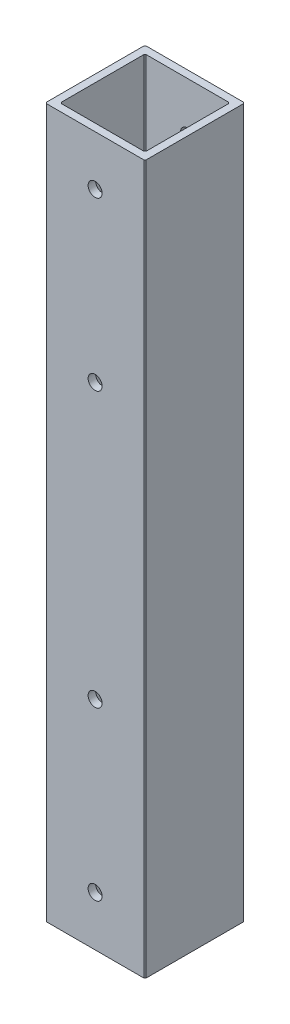
from build123d import *

# Parameters (mm, degrees)
SKETCH1_W                      = 284
SKETCH1_H                      = 40
BOSS_EXTRUDE1_DEPTH            = 40
SKETCH2_W                      = 34
SKETCH2_H                      = 34
CUT_EXTRUDE1_DEPTH             = 397.429060489
F_5_6_5_6_DIAMETER_HOLE1_D     = 5.6
F_5_6_5_6_DIAMETER_HOLE1_DEPTH = 3
F_5_6_5_6_DIAMETER_HOLE2_D     = 5.6
CHAMFER1_SIZE                  = 0.5


with BuildPart() as part:
    # Sketch1 → Boss-Extrude1 (new body)
    with BuildSketch(Plane(origin=(-210, 0, 0), x_dir=(0, -1, 0), z_dir=(-1, 0, 0))):
        with Locations((0, 160)):
            Rectangle(SKETCH1_W, SKETCH1_H)
    extrude(amount=-BOSS_EXTRUDE1_DEPTH)

    # Sketch2 → Cut-Extrude1 (cut, through all)
    with BuildSketch(Plane.XZ.offset(142)):
        with Locations((-190, 160)):
            Rectangle(SKETCH2_W, SKETCH2_H)
    extrude(amount=-CUT_EXTRUDE1_DEPTH, mode=Mode.SUBTRACT)

    # Ø5.6 (5.6) Diameter Hole1
    with Locations(Plane(origin=(0, 0, 140), x_dir=(-1, 0, 0), z_dir=(0, 0, -1))):
        with Locations((190, 122), (190, 55), (190, -55), (190, -122)):
            Hole(F_5_6_5_6_DIAMETER_HOLE1_D / 2, depth=F_5_6_5_6_DIAMETER_HOLE1_DEPTH)

    # Ø5.6 (5.6) Diameter Hole2 (through all)
    with Locations(Plane(origin=(0, 0, 177), x_dir=(-1, 0, 0), z_dir=(0, 0, -1))):
        with Locations((190, 122), (190, 55), (190, -55), (190, -122)):
            Hole(F_5_6_5_6_DIAMETER_HOLE2_D / 2)

    # Chamfer1
    chamfer1_edges = [part.edges().sort_by_distance(p)[0] for p in [
        (-170, 0, 140),
        (-173, 0, 143),
        (-207, 0, 143),
        (-207, 0, 177),
        (-173, 0, 177),
        (-170, 0, 180),
        (-210, 0, 140),
        (-210, 0, 180),
    ]]
    chamfer(chamfer1_edges, length=CHAMFER1_SIZE)


solid = part.part
